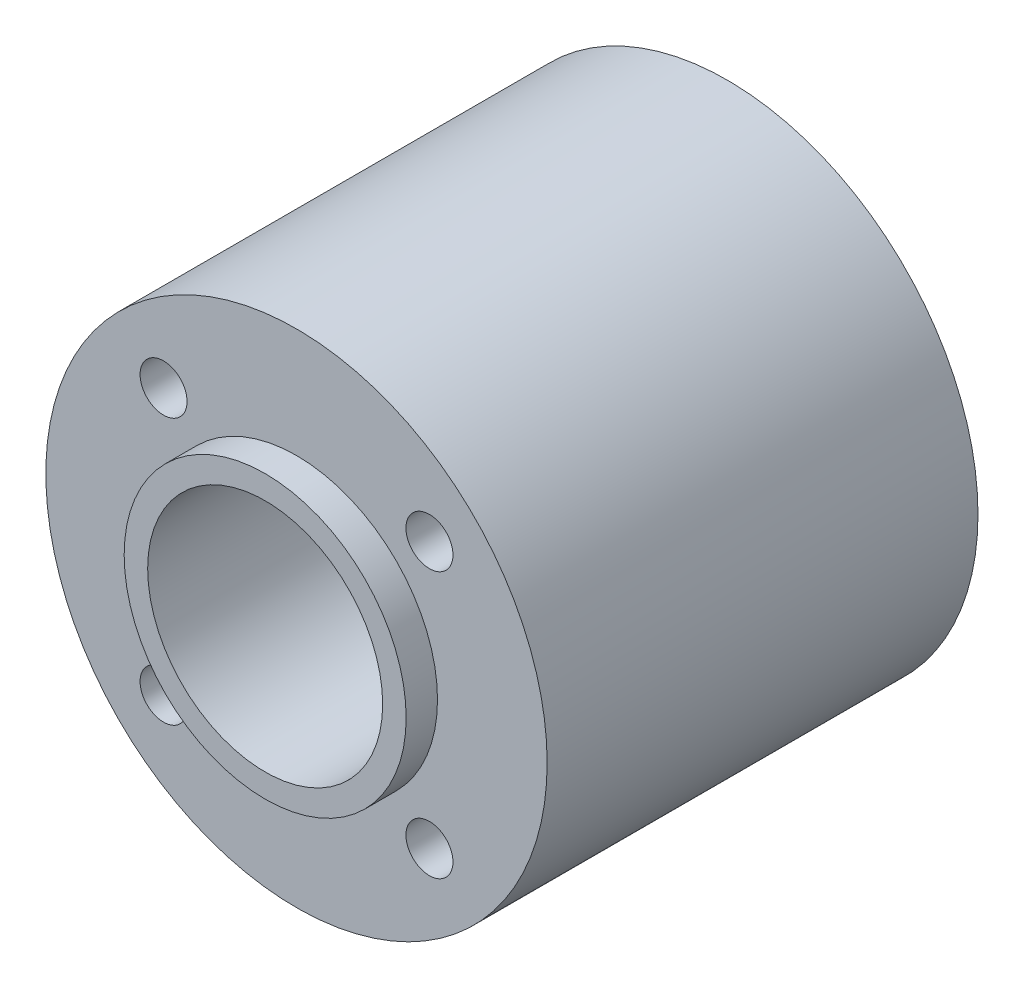
from build123d import *

# Parameters (mm, degrees)
SKETCH1_R           = 16
SKETCH1_R_2         = 9
SKETCH1_R_3         = 7.5
BOSS_EXTRUDE1_DEPTH = 27.5
BOSS_EXTRUDE2_START = 2
SKETCH1_3_R         = 9
SKETCH1_3_R_2       = 7.5
BOSS_EXTRUDE2_DEPTH = 2
BOSS_EXTRUDE3_START = -27.5
SKETCH1_4_R         = 9
SKETCH1_4_R_2       = 7.5
BOSS_EXTRUDE3_DEPTH = 2
SKETCH2_R           = 1.5
CUT_EXTRUDE1_DEPTH  = 38.17862289


with BuildPart() as part:
    # Sketch1 → Boss-Extrude1 (new body)
    # profile 1 of 2: a face of its own
    with BuildSketch(Plane.XY):
        Circle(SKETCH1_R)
        Circle(SKETCH1_R_2, mode=Mode.SUBTRACT)
    # profile 2 of 2: a face of its own
    with BuildSketch(Plane.XY):
        Circle(SKETCH1_R_2)
        Circle(SKETCH1_R_3, mode=Mode.SUBTRACT)
    extrude(amount=-BOSS_EXTRUDE1_DEPTH)

    # Sketch1<3> → Boss-Extrude2 (add)
    with BuildSketch(Plane.XY.offset(BOSS_EXTRUDE2_START)):
        Circle(SKETCH1_3_R)
        Circle(SKETCH1_3_R_2, mode=Mode.SUBTRACT)
    extrude(amount=-BOSS_EXTRUDE2_DEPTH)

    # Sketch1<4> → Boss-Extrude3 (add)
    with BuildSketch(Plane.XY.offset(BOSS_EXTRUDE3_START)):
        Circle(SKETCH1_4_R)
        Circle(SKETCH1_4_R_2, mode=Mode.SUBTRACT)
    extrude(amount=-BOSS_EXTRUDE3_DEPTH)

    # Sketch2 → Cut-Extrude1 (cut, through all)
    with BuildSketch(Plane.XY):
        with Locations((-8.485281374, 8.485281374)):
            Circle(SKETCH2_R)
        with Locations((8.485281374, 8.485281374)):
            Circle(SKETCH2_R)
        with Locations((8.485281374, -8.485281374)):
            Circle(SKETCH2_R)
        with Locations((-8.485281374, -8.485281374)):
            Circle(SKETCH2_R)
    extrude(amount=-CUT_EXTRUDE1_DEPTH, mode=Mode.SUBTRACT)


solid = part.part
